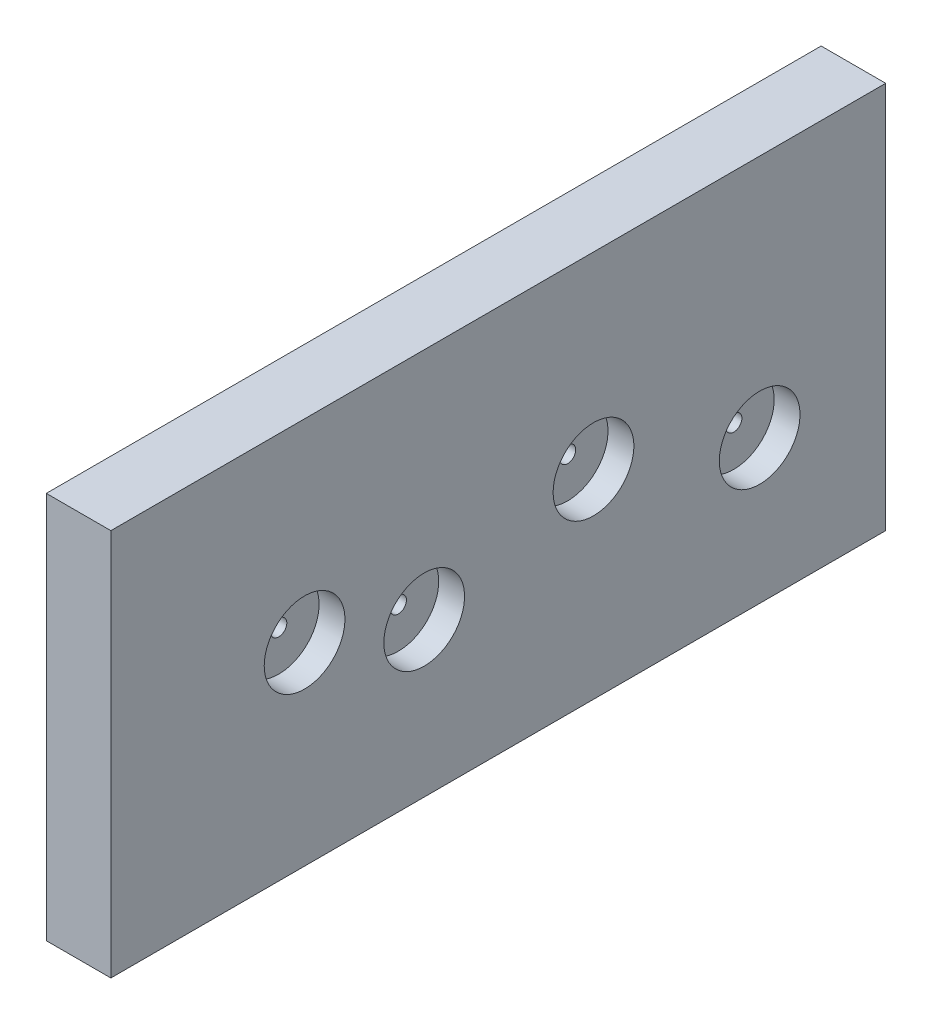
from build123d import *

# Parameters (mm, degrees)
SKETCH1_R                       = 1.5875
BOSS_EXTRUDE1_DEPTH             = 12.7
SKETCH2_R                       = 7.9375
CUT_EXTRUDE1_DEPTH              = 5.08
F_1_4_0_25_DIAMETER_HOLE1_D     = 6.35
F_1_4_0_25_DIAMETER_HOLE1_DEPTH = 38.1
F_1_4_0_25_DIAMETER_HOLE1_TIP   = 1.907732465


with BuildPart() as part:
    # Sketch1 → Boss-Extrude1 (new body)
    # profile 1 of 2: a face of its own
    with BuildSketch(Plane(origin=(0, 0, 0), x_dir=(0, 0, -1), z_dir=(1, 0, 0))):
        with BuildLine():
            Line((-76.2, 38.1), (-76.2, 0))
            Line((-76.2, 0), (-39.6875, 0))
            ThreePointArc((-39.6875, 0), (-38.1, 1.5875), (-36.5125, 0))
            Line((-36.5125, 0), (17.574154238, 0))
            ThreePointArc((17.574154238, 0), (18.13214729, 2.569713286), (20.31003158, 1.096077429))
            ThreePointArc((20.31003158, 1.096077429), (20.196167438, 0.505693139), (19.870908922, 0))
            Line((19.870908922, 0), (76.2, 0))
            Line((76.2, 0), (76.2, 38.1))
            Line((76.2, 38.1), (-76.2, 38.1))
        make_face()
    # profile 2 of 2: a face of its own
    with BuildSketch(Plane(origin=(0, 0, 0), x_dir=(0, 0, -1), z_dir=(1, 0, 0))):
        with BuildLine():
            Line((-39.6875, 0), (-76.2, 0))
            Line((-76.2, 0), (-76.2, -38.1))
            Line((-76.2, -38.1), (76.2, -38.1))
            Line((76.2, -38.1), (76.2, 0))
            Line((76.2, 0), (19.870908922, 0))
            ThreePointArc((19.870908922, 0), (18.72253158, -0.491422571), (17.574154238, 0))
            Line((17.574154238, 0), (-36.5125, 0))
            ThreePointArc((-36.5125, 0), (-38.1, -1.5875), (-39.6875, 0))
        make_face()
        with Locations((-14.571224015, -7.860160654)):
            Circle(SKETCH1_R, mode=Mode.SUBTRACT)
        with Locations((51.408255992, -9.873506971)):
            Circle(SKETCH1_R, mode=Mode.SUBTRACT)
    extrude(amount=BOSS_EXTRUDE1_DEPTH)

    # Sketch2 → Cut-Extrude1 (cut)
    with BuildSketch(Plane.ZY.offset(-12.7)):
        with Locations((38.1, 0)):
            Circle(SKETCH2_R)
        with Locations((14.571224015, -7.860160654)):
            Circle(SKETCH2_R)
        with Locations((-18.72253158, 1.096077429)):
            Circle(SKETCH2_R)
        with Locations((-51.408255992, -9.873506971)):
            Circle(SKETCH2_R)
    extrude(amount=CUT_EXTRUDE1_DEPTH, mode=Mode.SUBTRACT)

    # 1/4 (0.25) Diameter Hole1
    with Locations(Plane.XZ.offset(38.1)):
        with Locations((6.35, -63.5), (6.35, 0), (6.35, 57.15)):
            Hole(F_1_4_0_25_DIAMETER_HOLE1_D / 2, depth=F_1_4_0_25_DIAMETER_HOLE1_DEPTH)
            with Locations((0, 0, -(F_1_4_0_25_DIAMETER_HOLE1_DEPTH + F_1_4_0_25_DIAMETER_HOLE1_TIP / 2))):  # 118° drill point
                Cone(0, F_1_4_0_25_DIAMETER_HOLE1_D / 2, F_1_4_0_25_DIAMETER_HOLE1_TIP, mode=Mode.SUBTRACT)


solid = part.part
